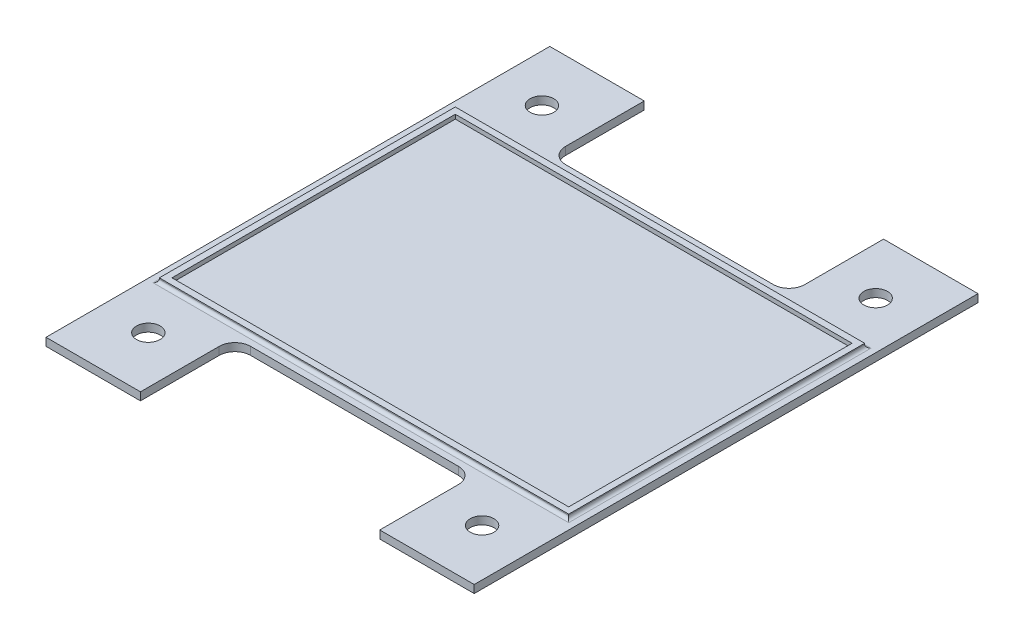
from build123d import *

# Parameters (mm, degrees)
SKETCH1_W                    = 172.72
SKETCH1_H                    = 203.2
BOSS_EXTRUDE1_DEPTH          = 3.175
SKETCH2_W                    = 96.52
SKETCH2_H                    = 38.1
CUT_EXTRUDE1_DEPTH           = 134.381746221
FILLET1_R                    = 6.35
SKETCH6_W                    = 165.1
SKETCH6_H                    = 119.38
SKETCH6_W_2                  = 160.02
SKETCH6_H_2                  = 114.3
BOSS_EXTRUDE2_DEPTH          = 1.7145
FILLET2_R                    = 1.27
F_3_8_0_375_DIAMETER_HOLE1_D = 9.525
MIRROR5_COPY_1_D             = 9.525


with BuildPart() as part:
    # Sketch1 → Boss-Extrude1 (new body)
    with BuildSketch(Plane(origin=(0, 0, 0), x_dir=(1, 0, 0), z_dir=(0, 1, 0))):
        Rectangle(SKETCH1_W, SKETCH1_H)
    extrude(amount=BOSS_EXTRUDE1_DEPTH)

    # Sketch2 → Cut-Extrude1 (cut, through all)
    with BuildSketch(Plane(origin=(0, 3.175, 0), x_dir=(1, 0, 0), z_dir=(0, 1, 0))):
        with Locations((0, 82.55)):
            Rectangle(SKETCH2_W, SKETCH2_H)
        with Locations((0, -82.55)):
            Rectangle(SKETCH2_W, SKETCH2_H)
    extrude(amount=-CUT_EXTRUDE1_DEPTH, mode=Mode.SUBTRACT)

    # Fillet1
    fillet1_edges = [part.edges().sort_by_distance(p)[0] for p in [
        (-48.26, 1.5875, -63.5),
        (48.26, 1.5875, -63.5),
        (-48.26, 1.5875, 63.5),
        (48.26, 1.5875, 63.5),
    ]]
    fillet(fillet1_edges, radius=FILLET1_R)

    # Sketch6 → Boss-Extrude2 (add)
    with BuildSketch(Plane(origin=(0, 3.175, 0), x_dir=(1, 0, 0), z_dir=(0, 1, 0))):
        Rectangle(SKETCH6_W, SKETCH6_H)
        Rectangle(SKETCH6_W_2, SKETCH6_H_2, mode=Mode.SUBTRACT)
    extrude(amount=BOSS_EXTRUDE2_DEPTH)

    # Fillet2
    fillet2_edges = [part.edges().sort_by_distance(p)[0] for p in [
        (82.55, 3.175, 0),
        (0, 3.175, -59.69),
        (-82.55, 3.175, 0),
        (0, 3.175, 59.69),
    ]]
    fillet(fillet2_edges, radius=FILLET2_R)

    # 3/8 (0.375) Diameter Hole1 (through all)
    with Locations(Plane(origin=(0, 3.175, 0), x_dir=(1, 0, 0), z_dir=(0, 1, 0))):
        with Locations((-67.31, -79.375)):
            f_3_8_0_375_diameter_hole1 = Hole(F_3_8_0_375_DIAMETER_HOLE1_D / 2)

    # Mirror4: 3/8 (0.375) Diameter Hole1 across plane
    add(f_3_8_0_375_diameter_hole1.mirror(Plane.XY), mode=Mode.SUBTRACT)

    # Mirror5: 3/8 (0.375) Diameter Hole1 across plane
    add(f_3_8_0_375_diameter_hole1.mirror(Plane(origin=(0, 0, 0), x_dir=(0, 0, 1), z_dir=(1, 0, 0))), mode=Mode.SUBTRACT)

    # Mirror5 copy 1 (through all)
    with Locations(Plane(origin=(0, 3.175, 0), x_dir=(-1, 0, 0), z_dir=(0, 1, 0))):
        with Locations((-67.31, -79.375)):
            Hole(MIRROR5_COPY_1_D / 2)


solid = part.part
